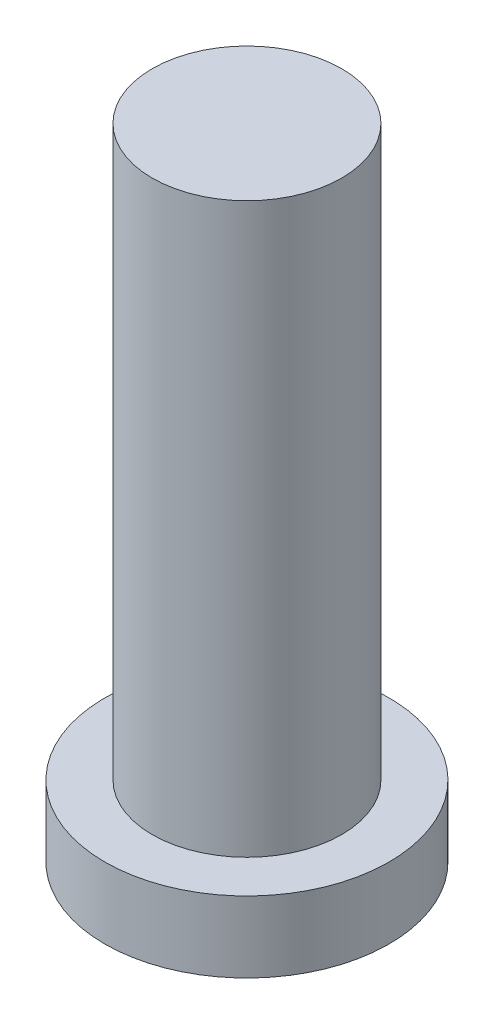
from build123d import *

# Parameters (mm, degrees)
SKETCH2_R           = 3
BOSS_EXTRUDE1_DEPTH = 1.5
SKETCH3_R           = 2
BOSS_EXTRUDE2_DEPTH = 12


with BuildPart() as part:
    # Sketch2 → Boss-Extrude1 (new body)
    with BuildSketch(Plane(origin=(0, 0, 0), x_dir=(1, 0, 0), z_dir=(0, 1, 0))):
        with Locations(Location((0, 0, 0), (0, 0, 270))):
            Circle(SKETCH2_R)
    extrude(amount=BOSS_EXTRUDE1_DEPTH)

    # Sketch3 → Boss-Extrude2 (add)
    with BuildSketch(Plane(origin=(0, 1.5, 0), x_dir=(1, 0, 0), z_dir=(0, 1, 0))):
        with Locations(Location((0, 0, 0), (0, 0, 270))):
            Circle(SKETCH3_R)
    extrude(amount=BOSS_EXTRUDE2_DEPTH)


solid = part.part
